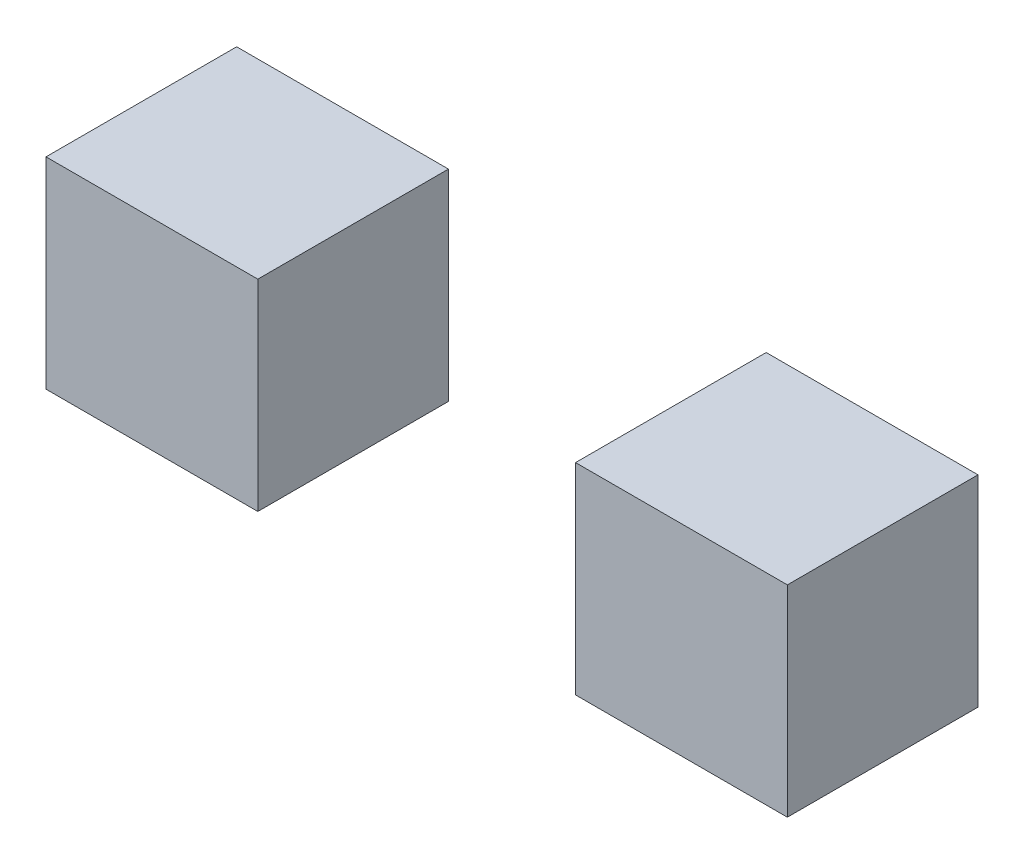
from build123d import *

# Parameters (mm, degrees)
BOSS_EXTRUDE2_DEPTH = 9
SKETCH2_W           = 10
SKETCH2_H           = 9.5
BOSS_EXTRUDE3_DEPTH = 9
SKETCH3_W           = 15
SKETCH3_H           = 36.865736843
CUT_EXTRUDE2_DEPTH  = 9


with BuildPart() as part:
    # Sketch1 → Boss-Extrude2 (new body)
    with BuildSketch(Plane.XY):
        Polygon((-4.75, -14.75), (4.75, -14.75), (4.75, -4.75), (14.75, -4.75), (14.75, 4.75), (4.75, 4.75), (4.75, 14.75), (-4.75, 14.75), (-4.75, 4.75), (-14.75, 4.75), (-14.75, -4.75), (-4.75, -4.75), align=None)
    extrude(amount=BOSS_EXTRUDE2_DEPTH)

    # Sketch2 → Boss-Extrude3 (add)
    with BuildSketch(Plane.XY.offset(9)):
        with Locations((15.25, 0)):
            Rectangle(SKETCH2_W, SKETCH2_H)
    extrude(amount=-BOSS_EXTRUDE3_DEPTH)

    # Sketch3 → Cut-Extrude2 (cut)
    with BuildSketch(Plane.XY.offset(9)):
        with Locations((2.75, 3.682868421)):
            Rectangle(SKETCH3_W, SKETCH3_H)
    extrude(amount=-CUT_EXTRUDE2_DEPTH, mode=Mode.SUBTRACT)


with BuildPart() as cut_extrude2_piece_1:
    # of the separate pieces the step leaves, piece 1, a body of its own (cut_extrude2_pieces)
    add(part.part.solids().sort_by_distance((-14.75, -4.75, 0))[0])


with BuildPart() as cut_extrude2_piece_2:
    # of the separate pieces the step leaves, piece 2, a body of its own (cut_extrude2_pieces)
    add(part.part.solids().sort_by_distance((10.25, -4.75, 0))[0])


solid = Compound([cut_extrude2_piece_1.part, cut_extrude2_piece_2.part])
